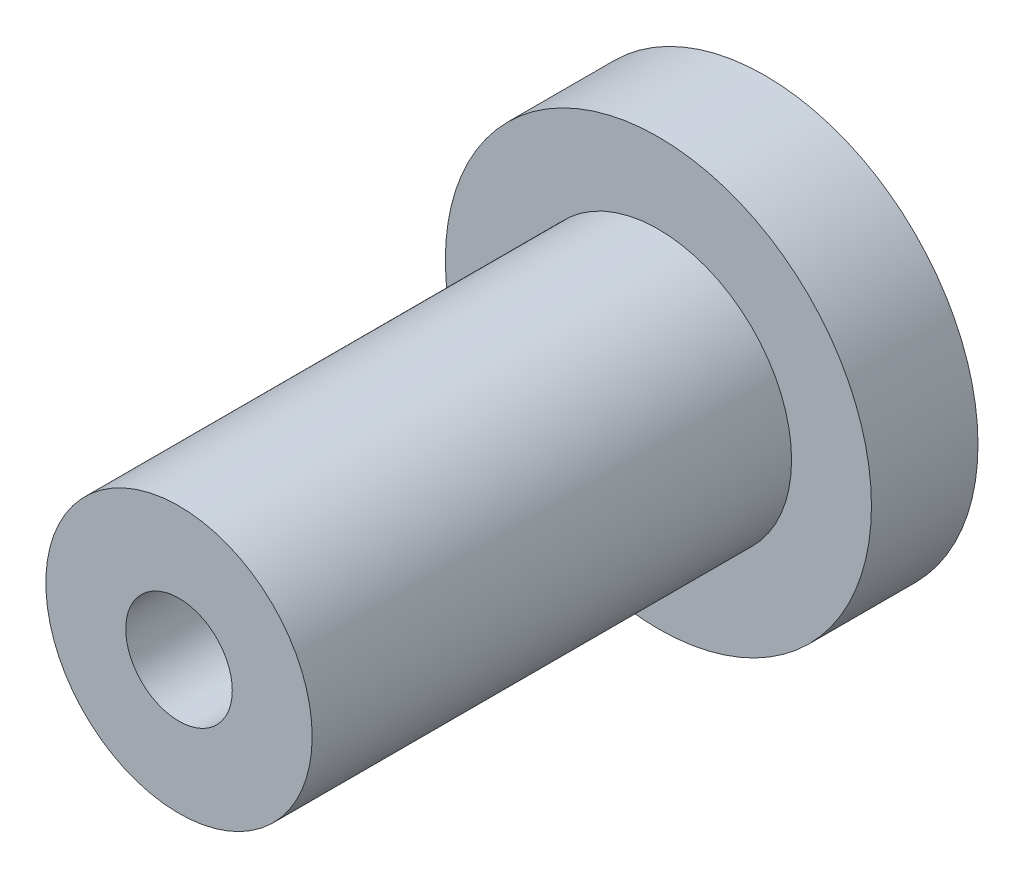
from build123d import *

# Parameters (mm, degrees)
SKETCH_1_R      = 4
SKETCH_1_R_2    = 1
EXTRUDE_1_DEPTH = 2
SKETCH_1_3_R    = 2.5
SKETCH_1_3_R_2  = 1
EXTRUDE_2_DEPTH = 11


with BuildPart() as part:
    # Эскиз1 → Бобышка-Вытянуть1 (new body)
    with BuildSketch(Plane.XY):
        Circle(SKETCH_1_R)
        Circle(SKETCH_1_R_2, mode=Mode.SUBTRACT)
    extrude(amount=EXTRUDE_1_DEPTH)

    # Эскиз1<3> → Бобышка-Вытянуть2 (add)
    with BuildSketch(Plane.XY):
        Circle(SKETCH_1_3_R)
        Circle(SKETCH_1_3_R_2, mode=Mode.SUBTRACT)
    extrude(amount=EXTRUDE_2_DEPTH)


solid = part.part
